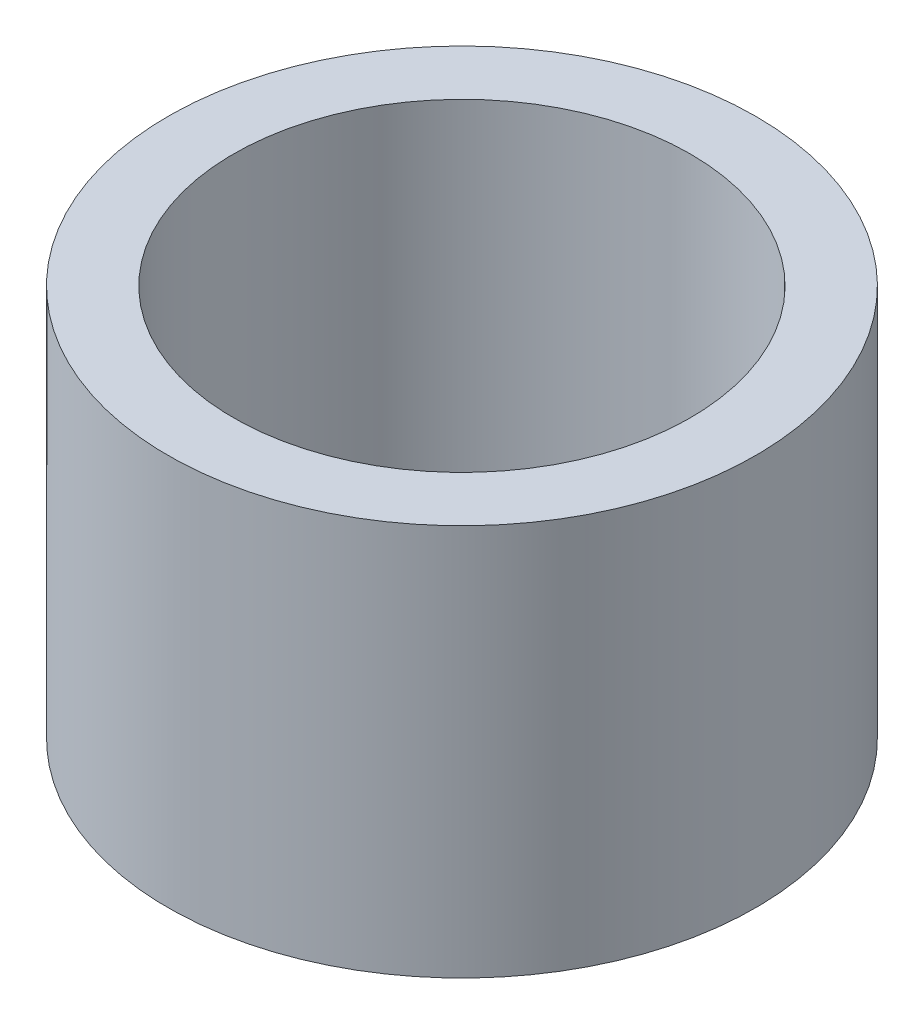
from build123d import *

# Parameters (mm, degrees)
SKETCH1_R           = 28.575
SKETCH1_R_2         = 22.225
BOSS_EXTRUDE1_DEPTH = 38.1


with BuildPart() as part:
    # Sketch1 → Boss-Extrude1 (new body)
    with BuildSketch(Plane(origin=(0, 0, 0), x_dir=(1, 0, 0), z_dir=(0, 1, 0))):
        with Locations(Location((0, 0, 0), (0, 0, 90))):
            Circle(SKETCH1_R)
        with Locations(Location((0, 0, 0), (0, 0, 90))):
            Circle(SKETCH1_R_2, mode=Mode.SUBTRACT)
    extrude(amount=BOSS_EXTRUDE1_DEPTH)


solid = part.part
